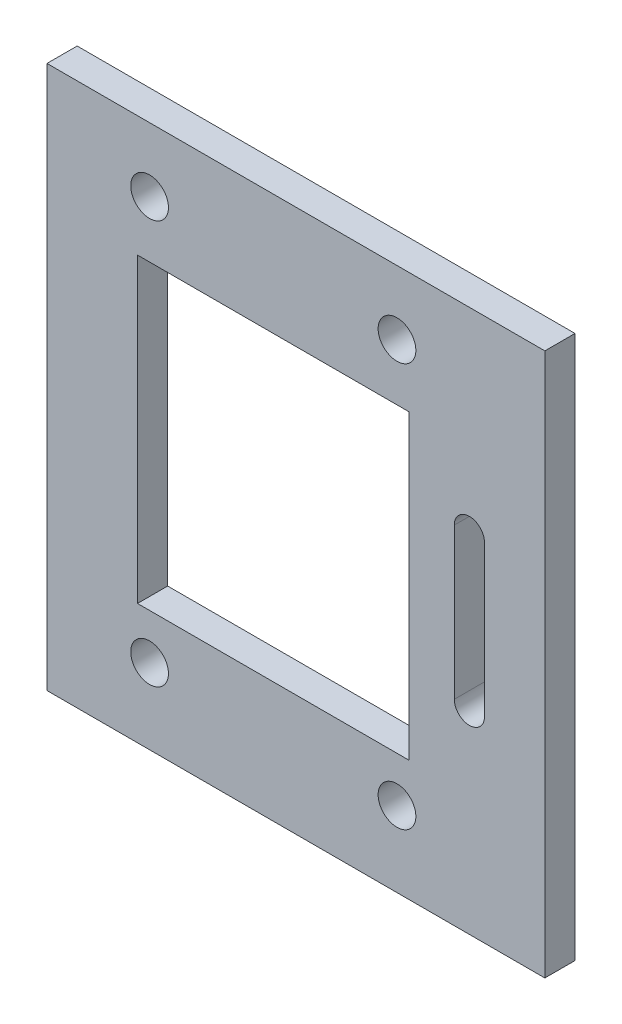
from build123d import *

# Parameters (mm, degrees)
SKETCH1_W           = 66
SKETCH1_H           = 72
SKETCH1_W_2         = 36
SKETCH1_H_2         = 40
BOSS_EXTRUDE1_DEPTH = 4
SKETCH2_R           = 2.5
CUT_EXTRUDE1_DEPTH  = 10
CUT_EXTRUDE3_DEPTH  = 10


with BuildPart() as part:
    # Sketch1 → Boss-Extrude1 (new body)
    with BuildSketch(Plane.XY):
        with Locations((33, 36)):
            Rectangle(SKETCH1_W, SKETCH1_H)
        with Locations((30, 36)):
            Rectangle(SKETCH1_W_2, SKETCH1_H_2, mode=Mode.SUBTRACT)
    extrude(amount=BOSS_EXTRUDE1_DEPTH)

    # Sketch2 → Cut-Extrude1 (cut)
    with BuildSketch(Plane.XY.offset(4)):
        with Locations((46.4, 63.5)):
            Circle(SKETCH2_R)
        with Locations((13.6, 63.5)):
            Circle(SKETCH2_R)
        with Locations((13.6, 10)):
            Circle(SKETCH2_R)
        with Locations((46.4, 10)):
            Circle(SKETCH2_R)
    extrude(amount=-CUT_EXTRUDE1_DEPTH, mode=Mode.SUBTRACT)

    # Sketch4 → Cut-Extrude3 (cut)
    with BuildSketch(Plane.XY.offset(4)):
        with BuildLine():
            Line((58, 46), (58, 26))
            ThreePointArc((58, 26), (56, 24), (54, 26))
            Line((54, 26), (54, 46))
            ThreePointArc((54, 46), (56, 48), (58, 46))
        make_face()
    extrude(amount=-CUT_EXTRUDE3_DEPTH, mode=Mode.SUBTRACT)


solid = part.part
